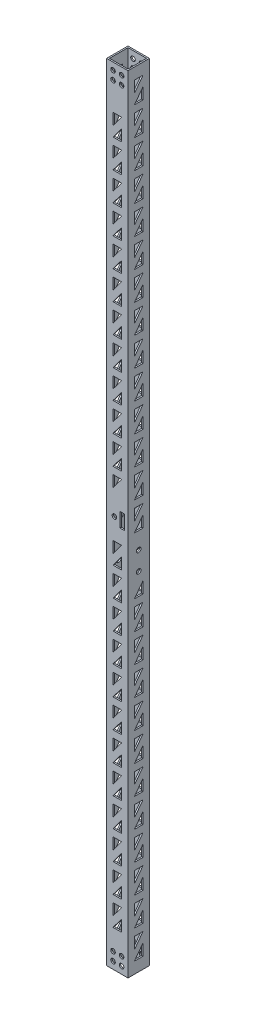
from build123d import *

# Parameters (mm, degrees)
SKETCH_1_W          = 15
SKETCH_1_H          = 15
SKETCH_1_W_2        = 13
SKETCH_1_H_2        = 13
EXTRUDE_1_DEPTH     = 551
SKETCH_2_R          = 1.6
SKETCH_2_W          = 3.1
SKETCH_2_H          = 10.1
CUT_EXTRUDE_1_DEPTH = 15
SKETCH_4_R          = 1.6
CUT_EXTRUDE_2_DEPTH = 15


with BuildPart() as part:
    # 草图1 → 凸台-拉伸1 (new body)
    with BuildSketch(Plane(origin=(0, 0, 0), x_dir=(1, 0, 0), z_dir=(0, 1, 0))):
        Rectangle(SKETCH_1_W, SKETCH_1_H)
        Rectangle(SKETCH_1_W_2, SKETCH_1_H_2, mode=Mode.SUBTRACT)
    extrude(amount=EXTRUDE_1_DEPTH)

    # 草图2 → 切除-拉伸1 (cut)
    with BuildSketch(Plane.XY.offset(7.5)):
        with Locations((-3, 546)):
            Circle(SKETCH_2_R)
        with Locations((3, 546)):
            Circle(SKETCH_2_R)
        with Locations((-3, 540)):
            Circle(SKETCH_2_R)
        with Locations((3, 540)):
            Circle(SKETCH_2_R)
        with Locations((3, 11)):
            Circle(SKETCH_2_R)
        with Locations((-3, 11)):
            Circle(SKETCH_2_R)
        with Locations((3, 5)):
            Circle(SKETCH_2_R)
        with Locations((-3, 5)):
            Circle(SKETCH_2_R)
        with Locations((-2, 275.5)):
            Circle(SKETCH_2_R)
        Polygon((-3, 512.5), (-3, 520.5), (3, 520.5), align=None)
        Polygon((-3, 505.5), (3, 505.5), (3, 513.5), align=None)
        Polygon((3, 500.5), (-3, 492.5), (-3, 500.5), align=None)
        Polygon((3, 493.5), (-3, 485.5), (3, 485.5), align=None)
        Polygon((3, 480.5), (-3, 472.5), (-3, 480.5), align=None)
        Polygon((3, 473.5), (-3, 465.5), (3, 465.5), align=None)
        Polygon((3, 460.5), (-3, 452.5), (-3, 460.5), align=None)
        Polygon((3, 453.5), (-3, 445.5), (3, 445.5), align=None)
        Polygon((3, 440.5), (-3, 432.5), (-3, 440.5), align=None)
        Polygon((3, 433.5), (-3, 425.5), (3, 425.5), align=None)
        Polygon((3, 420.5), (-3, 412.5), (-3, 420.5), align=None)
        Polygon((3, 413.5), (-3, 405.5), (3, 405.5), align=None)
        Polygon((3, 400.5), (-3, 392.5), (-3, 400.5), align=None)
        Polygon((3, 393.5), (-3, 385.5), (3, 385.5), align=None)
        Polygon((3, 380.5), (-3, 372.5), (-3, 380.5), align=None)
        Polygon((3, 373.5), (-3, 365.5), (3, 365.5), align=None)
        Polygon((3, 360.5), (-3, 352.5), (-3, 360.5), align=None)
        Polygon((3, 353.5), (-3, 345.5), (3, 345.5), align=None)
        Polygon((3, 340.5), (-3, 332.5), (-3, 340.5), align=None)
        Polygon((3, 333.5), (-3, 325.5), (3, 325.5), align=None)
        Polygon((3, 320.5), (-3, 312.5), (-3, 320.5), align=None)
        Polygon((3, 313.5), (-3, 305.5), (3, 305.5), align=None)
        Polygon((3, 300.5), (-3, 292.5), (-3, 300.5), align=None)
        Polygon((3, 233.5), (-3, 225.5), (3, 225.5), align=None)
        Polygon((3, 220.5), (-3, 212.5), (-3, 220.5), align=None)
        Polygon((3, 213.5), (-3, 205.5), (3, 205.5), align=None)
        Polygon((3, 200.5), (-3, 192.5), (-3, 200.5), align=None)
        Polygon((3, 193.5), (-3, 185.5), (3, 185.5), align=None)
        Polygon((3, 180.5), (-3, 172.5), (-3, 180.5), align=None)
        Polygon((3, 173.5), (-3, 165.5), (3, 165.5), align=None)
        Polygon((3, 160.5), (-3, 152.5), (-3, 160.5), align=None)
        Polygon((3, 153.5), (-3, 145.5), (3, 145.5), align=None)
        Polygon((3, 140.5), (-3, 132.5), (-3, 140.5), align=None)
        Polygon((3, 133.5), (-3, 125.5), (3, 125.5), align=None)
        Polygon((3, 120.5), (-3, 112.5), (-3, 120.5), align=None)
        Polygon((3, 113.5), (-3, 105.5), (3, 105.5), align=None)
        Polygon((3, 100.5), (-3, 92.5), (-3, 100.5), align=None)
        Polygon((3, 93.5), (-3, 85.5), (3, 85.5), align=None)
        Polygon((3, 80.5), (-3, 72.5), (-3, 80.5), align=None)
        Polygon((3, 73.5), (-3, 65.5), (3, 65.5), align=None)
        Polygon((3, 60.5), (-3, 52.5), (-3, 60.5), align=None)
        Polygon((3, 53.5), (-3, 45.5), (3, 45.5), align=None)
        Polygon((3, 40.5), (-3, 32.5), (-3, 40.5), align=None)
        Polygon((3, 33.5), (-3, 25.5), (3, 25.5), align=None)
        Polygon((3, 260.5), (-3, 252.5), (-3, 260.5), align=None)
        Polygon((3, 240.5), (-3, 232.5), (-3, 240.5), align=None)
        Polygon((3, 253.5), (-3, 245.5), (3, 245.5), align=None)
        with Locations((3.5, 275.5)):
            Rectangle(SKETCH_2_W, SKETCH_2_H)
    extrude(amount=-CUT_EXTRUDE_1_DEPTH, mode=Mode.SUBTRACT)

    # 草图4 → 切除-拉伸2 (cut)
    with BuildSketch(Plane(origin=(7.5, 0, 0), x_dir=(0, 0, -1), z_dir=(1, 0, 0))):
        with Locations((0, 256.2)):
            Circle(SKETCH_4_R)
        with Locations((0, 243.2)):
            Circle(SKETCH_4_R)
        Polygon((-3, 543), (3, 543), (-3, 535), align=None)
        Polygon((-3, 528), (3, 536), (3, 528), align=None)
        Polygon((-3, 515), (-3, 523), (3, 523), align=None)
        Polygon((3, 508), (-3, 508), (3, 516), align=None)
        Polygon((-3, 495), (-3, 503), (3, 503), align=None)
        Polygon((3, 488), (-3, 488), (3, 496), align=None)
        Polygon((-3, 475), (-3, 483), (3, 483), align=None)
        Polygon((3, 468), (-3, 468), (3, 476), align=None)
        Polygon((-3, 455), (-3, 463), (3, 463), align=None)
        Polygon((3, 448), (-3, 448), (3, 456), align=None)
        Polygon((-3, 435), (-3, 443), (3, 443), align=None)
        Polygon((3, 428), (-3, 428), (3, 436), align=None)
        Polygon((-3, 415), (-3, 423), (3, 423), align=None)
        Polygon((3, 408), (-3, 408), (3, 416), align=None)
        Polygon((-3, 395), (-3, 403), (3, 403), align=None)
        Polygon((3, 388), (-3, 388), (3, 396), align=None)
        Polygon((-3, 375), (-3, 383), (3, 383), align=None)
        Polygon((3, 368), (-3, 368), (3, 376), align=None)
        Polygon((-3, 355), (-3, 363), (3, 363), align=None)
        Polygon((3, 348), (-3, 348), (3, 356), align=None)
        Polygon((-3, 335), (-3, 343), (3, 343), align=None)
        Polygon((3, 328), (-3, 328), (3, 336), align=None)
        Polygon((-3, 315), (-3, 323), (3, 323), align=None)
        Polygon((3, 308), (-3, 308), (3, 316), align=None)
        Polygon((-3, 295), (-3, 303), (3, 303), align=None)
        Polygon((3, 288), (-3, 288), (3, 296), align=None)
        Polygon((-3, 275), (-3, 283), (3, 283), align=None)
        Polygon((3, 268), (-3, 268), (3, 276), align=None)
        Polygon((3, 228), (-3, 228), (3, 236), align=None)
        Polygon((-3, 215), (-3, 223), (3, 223), align=None)
        Polygon((3, 208), (-3, 208), (3, 216), align=None)
        Polygon((-3, 195), (-3, 203), (3, 203), align=None)
        Polygon((3, 188), (-3, 188), (3, 196), align=None)
        Polygon((-3, 175), (-3, 183), (3, 183), align=None)
        Polygon((3, 168), (-3, 168), (3, 176), align=None)
        Polygon((-3, 155), (-3, 163), (3, 163), align=None)
        Polygon((3, 148), (-3, 148), (3, 156), align=None)
        Polygon((-3, 135), (-3, 143), (3, 143), align=None)
        Polygon((3, 128), (-3, 128), (3, 136), align=None)
        Polygon((-3, 115), (-3, 123), (3, 123), align=None)
        Polygon((3, 108), (-3, 108), (3, 116), align=None)
        Polygon((-3, 95), (-3, 103), (3, 103), align=None)
        Polygon((3, 88), (-3, 88), (3, 96), align=None)
        Polygon((-3, 75), (-3, 83), (3, 83), align=None)
        Polygon((3, 68), (-3, 68), (3, 76), align=None)
        Polygon((-3, 55), (-3, 63), (3, 63), align=None)
        Polygon((3, 48), (-3, 48), (3, 56), align=None)
        Polygon((-3, 35), (-3, 43), (3, 43), align=None)
        Polygon((3, 28), (-3, 28), (3, 36), align=None)
        Polygon((-3, 15), (-3, 23), (3, 23), align=None)
        Polygon((3, 8), (-3, 8), (3, 16), align=None)
    extrude(amount=-CUT_EXTRUDE_2_DEPTH, mode=Mode.SUBTRACT)


solid = part.part
